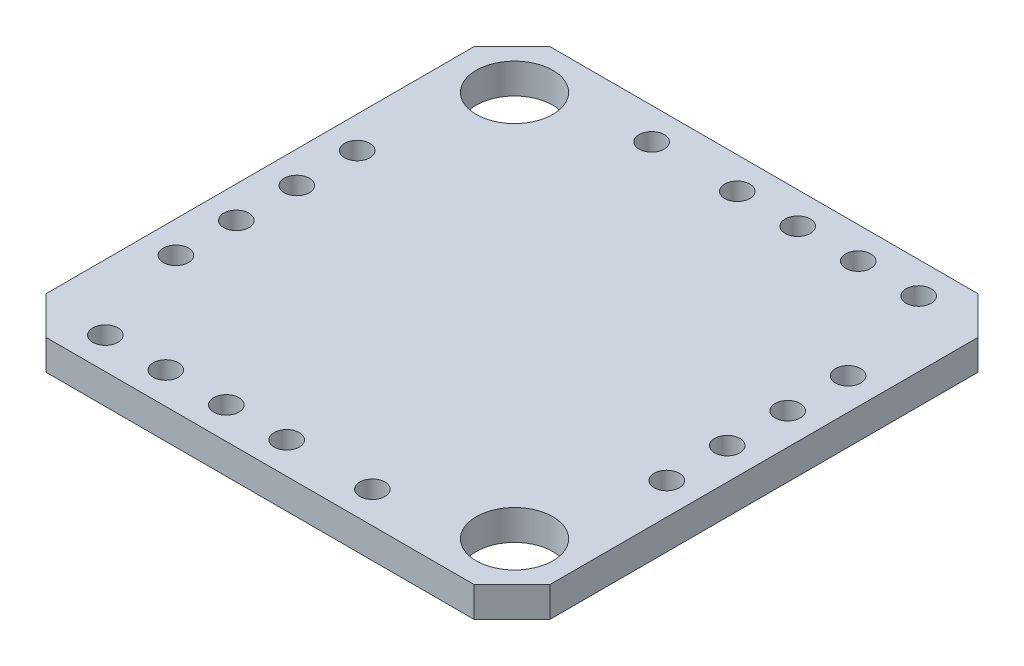
from build123d import *

# Parameters (mm, degrees)
SKETCH1_W           = 10
SKETCH1_H           = 10
BOSS_EXTRUDE1_DEPTH = 0.6
CHAMFER1_SIZE       = 0.75
SKETCH2_R           = 0.76
CUT_EXTRUDE1_DEPTH  = 8.096478
SKETCH13_R          = 0.959787046
BOSS_EXTRUDE2_DEPTH = 0.6
CUT_EXTRUDE9_REACH  = 9.096
SKETCH14_R          = 0.25
LPATTERN5_COUNT     = 2
LPATTERN5_PITCH     = 1.2
LPATTERN5_COL_COUNT = 3
LPATTERN5_COL_PITCH = 1.2
CUT_EXTRUDE10_REACH = 9.096
SKETCH17_R          = 0.25
LPATTERN6_COUNT     = 2
LPATTERN6_PITCH     = 1.2
LPATTERN6_COL_COUNT = 3
LPATTERN6_COL_PITCH = 1.2
CUT_EXTRUDE11_REACH = 9.096
SKETCH18_R          = 0.25
LPATTERN7_COUNT     = 2
LPATTERN7_PITCH     = 1.2
LPATTERN7_COL_COUNT = 3
LPATTERN7_COL_PITCH = 1.2
CUT_EXTRUDE12_REACH = 9.096
SKETCH19_R          = 0.25
CUT_EXTRUDE13_REACH = 9.096
SKETCH20_R          = 0.25
CUT_EXTRUDE14_REACH = 9.096
SKETCH21_R          = 0.25
LPATTERN8_COUNT     = 2
LPATTERN8_PITCH     = 1.2
LPATTERN8_COL_COUNT = 3
LPATTERN8_COL_PITCH = 1.2


with BuildPart() as part:
    # Sketch1 → Boss-Extrude1 (new body)
    with BuildSketch(Plane(origin=(0, 0, 0), x_dir=(1, 0, 0), z_dir=(0, 1, 0))):
        Rectangle(SKETCH1_W, SKETCH1_H)
    extrude(amount=BOSS_EXTRUDE1_DEPTH)

    # Chamfer1
    chamfer1_edges = [part.edges().sort_by_distance(p)[0] for p in [
        (5, 0.3, 5),
        (-5, 0.3, 5),
        (-5, 0.3, -5),
        (5, 0.3, -5),
    ]]
    chamfer(chamfer1_edges, length=CHAMFER1_SIZE)

    # Sketch2 → Cut-Extrude1 (cut, through all)
    with BuildSketch(Plane(origin=(0, 0.6, 0), x_dir=(1, 0, 0), z_dir=(0, 1, 0))):
        with Locations(Location((-3.811827202, 3.861827202, 0), (0, 0, 270))):
            Circle(SKETCH2_R)
    cut_extrude1 = extrude(amount=-CUT_EXTRUDE1_DEPTH, mode=Mode.SUBTRACT)

    # Mirror2: Cut-Extrude1 across plane
    add(cut_extrude1.mirror(Plane(origin=(0, 0, 0), x_dir=(-0.7071067811865482, 0, 0.7071067811865468), z_dir=(-0.7071067811865468, 0, -0.7071067811865482))), mode=Mode.SUBTRACT)

    # Sketch13 → Boss-Extrude2 (add)
    with BuildSketch(Plane(origin=(0, 0.6, 0), x_dir=(1, 0, 0), z_dir=(0, 1, 0))):
        with Locations((3.861827202, -3.811827202)):
            Circle(SKETCH13_R)
    extrude(amount=-BOSS_EXTRUDE2_DEPTH)

    # Sketch14 → Cut-Extrude9 (cut, up to next)
    with BuildSketch(Plane(origin=(0, 0.6, 0), x_dir=(1, 0, 0), z_dir=(0, 1, 0)), mode=Mode.PRIVATE) as cut_extrude9_sk1:
        with Locations(Location((-4.3718272, 0.1, 0), (0, 0, 270))):
            Circle(SKETCH14_R)
    cut_extrude9_tool1 = extrude(cut_extrude9_sk1.sketch, amount=-CUT_EXTRUDE9_REACH, mode=Mode.PRIVATE) & part.part
    cut_extrude9 = cut_extrude9_tool1.solids().sort_by_distance((-4.371827, 0.6, -0.1))[0]
    add(cut_extrude9, mode=Mode.SUBTRACT)

    # LPattern5: Cut-Extrude9 ×2
    with Locations(*[(0, 0, -i * LPATTERN5_PITCH) for i in range(1, LPATTERN5_COUNT)]):
        add(cut_extrude9, mode=Mode.SUBTRACT)

    # LPattern5 col: Cut-Extrude9 ×3
    with Locations(*[(0, 0, i * LPATTERN5_COL_PITCH) for i in range(1, LPATTERN5_COL_COUNT)]):
        add(cut_extrude9, mode=Mode.SUBTRACT)

    # Mirror4: Cut-Extrude1 across plane
    add(cut_extrude1.mirror(Plane(origin=(0, 0, 0), x_dir=(-0.7071067811865482, 0, 0.7071067811865468), z_dir=(-0.7071067811865468, 0, -0.7071067811865482))), mode=Mode.SUBTRACT)

    # Sketch17 → Cut-Extrude10 (cut, up to next)
    with BuildSketch(Plane(origin=(0, 0.6, 0), x_dir=(1, 0, 0), z_dir=(0, 1, 0)), mode=Mode.PRIVATE) as cut_extrude10_sk1:
        with Locations(Location((-2.5, -4.3718272, 0), (0, 0, 270))):
            Circle(SKETCH17_R)
    cut_extrude10_tool1 = extrude(cut_extrude10_sk1.sketch, amount=-CUT_EXTRUDE10_REACH, mode=Mode.PRIVATE) & part.part
    cut_extrude10 = cut_extrude10_tool1.solids().sort_by_distance((-2.5, 0.6, 4.371827))[0]
    add(cut_extrude10, mode=Mode.SUBTRACT)

    # LPattern6: Cut-Extrude10 ×2
    with Locations(*[(-i * LPATTERN6_PITCH, 0, 0) for i in range(1, LPATTERN6_COUNT)]):
        add(cut_extrude10, mode=Mode.SUBTRACT)

    # LPattern6 col: Cut-Extrude10 ×3
    with Locations(*[(i * LPATTERN6_COL_PITCH, 0, 0) for i in range(1, LPATTERN6_COL_COUNT)]):
        add(cut_extrude10, mode=Mode.SUBTRACT)

    # Sketch18 → Cut-Extrude11 (cut, up to next)
    with BuildSketch(Plane(origin=(0, 0.6, 0), x_dir=(1, 0, 0), z_dir=(0, 1, 0)), mode=Mode.PRIVATE) as cut_extrude11_sk1:
        with Locations(Location((2.5, 4.3718272, 0), (0, 0, 270))):
            Circle(SKETCH18_R)
    cut_extrude11_tool1 = extrude(cut_extrude11_sk1.sketch, amount=-CUT_EXTRUDE11_REACH, mode=Mode.PRIVATE) & part.part
    cut_extrude11 = cut_extrude11_tool1.solids().sort_by_distance((2.5, 0.6, -4.371827))[0]
    add(cut_extrude11, mode=Mode.SUBTRACT)

    # LPattern7: Cut-Extrude11 ×2
    with Locations(*[(i * LPATTERN7_PITCH, 0, 0) for i in range(1, LPATTERN7_COUNT)]):
        add(cut_extrude11, mode=Mode.SUBTRACT)

    # LPattern7 col: Cut-Extrude11 ×3
    with Locations(*[(-i * LPATTERN7_COL_PITCH, 0, 0) for i in range(1, LPATTERN7_COL_COUNT)]):
        add(cut_extrude11, mode=Mode.SUBTRACT)

    # Sketch19 → Cut-Extrude12 (cut, up to next)
    with BuildSketch(Plane(origin=(0, 0.6, 0), x_dir=(1, 0, 0), z_dir=(0, 1, 0)), mode=Mode.PRIVATE) as cut_extrude12_sk1:
        with Locations(Location((1.6, -4.3718272, 0), (0, 0, 270))):
            Circle(SKETCH19_R)
    cut_extrude12_tool1 = extrude(cut_extrude12_sk1.sketch, amount=-CUT_EXTRUDE12_REACH, mode=Mode.PRIVATE) & part.part
    add(cut_extrude12_tool1.solids().sort_by_distance((1.6, 0.6, 4.371827))[0], mode=Mode.SUBTRACT)

    # Sketch20 → Cut-Extrude13 (cut, up to next)
    with BuildSketch(Plane(origin=(0, 0.6, 0), x_dir=(1, 0, 0), z_dir=(0, 1, 0)), mode=Mode.PRIVATE) as cut_extrude13_sk1:
        with Locations(Location((-1.6, 4.3718272, 0), (0, 0, 270))):
            Circle(SKETCH20_R)
    cut_extrude13_tool1 = extrude(cut_extrude13_sk1.sketch, amount=-CUT_EXTRUDE13_REACH, mode=Mode.PRIVATE) & part.part
    add(cut_extrude13_tool1.solids().sort_by_distance((-1.6, 0.6, -4.371827))[0], mode=Mode.SUBTRACT)

    # Sketch21 → Cut-Extrude14 (cut, up to next)
    with BuildSketch(Plane(origin=(0, 0.6, 0), x_dir=(1, 0, 0), z_dir=(0, 1, 0)), mode=Mode.PRIVATE) as cut_extrude14_sk1:
        with Locations(Location((4.3718272, -0.1, 0), (0, 0, 270))):
            Circle(SKETCH21_R)
    cut_extrude14_tool1 = extrude(cut_extrude14_sk1.sketch, amount=-CUT_EXTRUDE14_REACH, mode=Mode.PRIVATE) & part.part
    cut_extrude14 = cut_extrude14_tool1.solids().sort_by_distance((4.371827, 0.6, 0.1))[0]
    add(cut_extrude14, mode=Mode.SUBTRACT)

    # LPattern8: Cut-Extrude14 ×2
    with Locations(*[(0, 0, i * LPATTERN8_PITCH) for i in range(1, LPATTERN8_COUNT)]):
        add(cut_extrude14, mode=Mode.SUBTRACT)

    # LPattern8 col: Cut-Extrude14 ×3
    with Locations(*[(0, 0, -i * LPATTERN8_COL_PITCH) for i in range(1, LPATTERN8_COL_COUNT)]):
        add(cut_extrude14, mode=Mode.SUBTRACT)


solid = part.part
